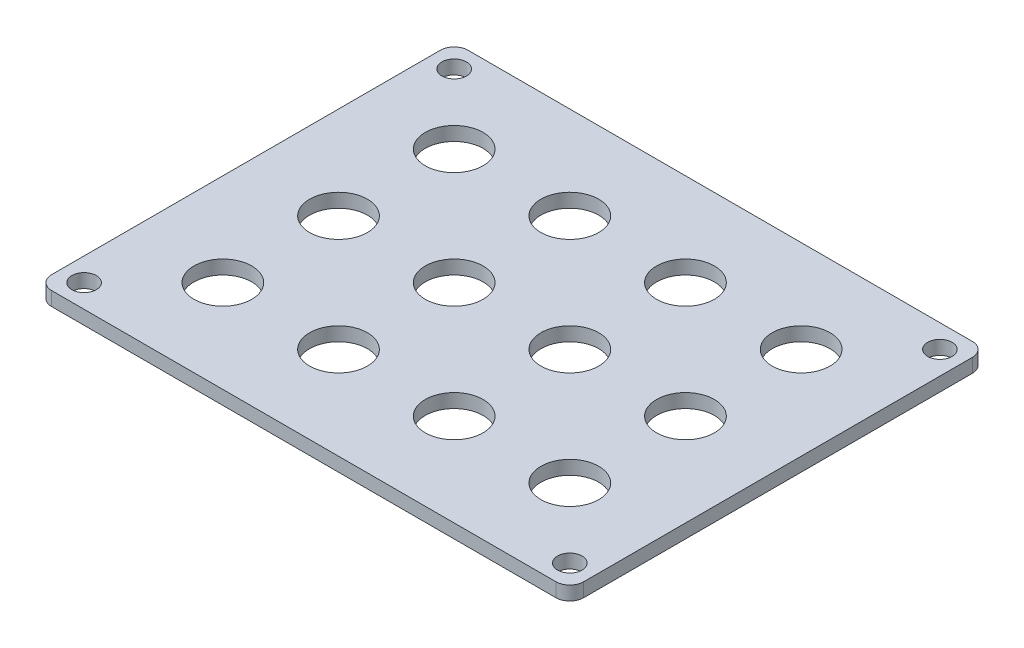
from build123d import *

# Parameters (mm, degrees)
SKETCH1_W            = 115
SKETCH1_H            = 90
BOSS_EXTRUDE1_DEPTH  = 3
SKETCH2_R            = 6.25
CUT_EXTRUDE1_DEPTH   = 3
LPATTERN1_COUNT      = 4
LPATTERN1_PITCH      = 25
LPATTERN1_COUNT_DIR2 = 3
LPATTERN1_PITCH_DIR2 = 25
FILLET1_R            = 3
M5_CLEARANCE_HOLE1_D = 5.3


with BuildPart() as part:
    # Sketch1 → Boss-Extrude1 (new body)
    with BuildSketch(Plane(origin=(0, 0, 0), x_dir=(1, 0, 0), z_dir=(0, 1, 0))):
        with Locations((57.5, 45)):
            Rectangle(SKETCH1_W, SKETCH1_H)
    extrude(amount=BOSS_EXTRUDE1_DEPTH)

    # Sketch2 → Cut-Extrude1 (cut)
    with BuildSketch(Plane(origin=(0, 3, 0), x_dir=(1, 0, 0), z_dir=(0, 1, 0))):
        with Locations(Location((20, 70, 0), (0, 0, 270))):
            Circle(SKETCH2_R)
    cut_extrude1 = extrude(amount=-CUT_EXTRUDE1_DEPTH, mode=Mode.SUBTRACT)

    # LPattern1: Cut-Extrude1 4 × 3
    with Locations(*[(i * LPATTERN1_PITCH, 0, j * LPATTERN1_PITCH_DIR2) for i in range(LPATTERN1_COUNT) for j in range(LPATTERN1_COUNT_DIR2) if (i, j) != (0, 0)]):
        add(cut_extrude1, mode=Mode.SUBTRACT)

    # Fillet1
    fillet1_edges = [part.edges().sort_by_distance(p)[0] for p in [
        (0, 1.5, -90),
        (115, 1.5, -90),
        (115, 1.5, 0),
        (0, 1.5, 0),
    ]]
    fillet(fillet1_edges, radius=FILLET1_R)

    # M5 Clearance Hole1 (through all)
    with Locations(Plane(origin=(0, 3, 0), x_dir=(1, 0, 0), z_dir=(0, 1, 0))):
        with Locations((5, 85), (5, 5), (110, 5), (110, 85)):
            Hole(M5_CLEARANCE_HOLE1_D / 2)


solid = part.part
